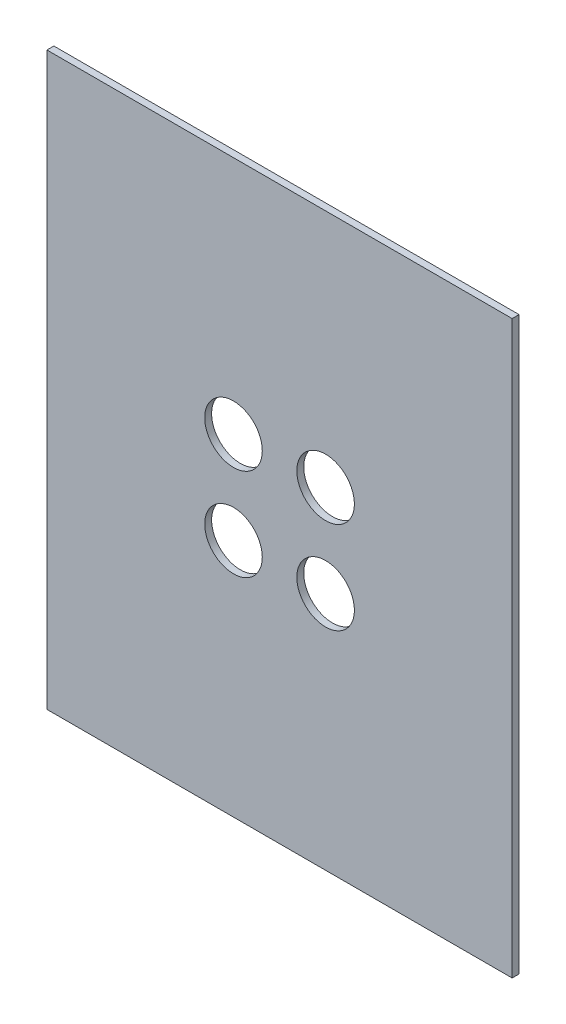
from build123d import *

# Parameters (mm, degrees)
ESQUISSE1_W             = 202
ESQUISSE1_H             = 248
BOSS_EXTRU_1_DEPTH      = 3
ESQUISSE2_R             = 12.5
ENL_V_MAT_EXTRU_1_DEPTH = 3


with BuildPart() as part:
    # Esquisse1 → Boss.-Extru.1 (new body)
    with BuildSketch(Plane.XY):
        with Locations((37.437440197, -46.807538036)):
            Rectangle(ESQUISSE1_W, ESQUISSE1_H)
    extrude(amount=BOSS_EXTRU_1_DEPTH)

    # Esquisse2 → Enlèv. mat.-Extru.1 (cut)
    with BuildSketch(Plane.XY.offset(3)):
        with Locations((17.437440197, -26.807538036)):
            Circle(ESQUISSE2_R)
        with Locations((57.437440197, -26.807538036)):
            Circle(ESQUISSE2_R)
        with Locations((57.437440197, -66.807538036)):
            Circle(ESQUISSE2_R)
        with Locations((17.437440197, -66.807538036)):
            Circle(ESQUISSE2_R)
    extrude(amount=-ENL_V_MAT_EXTRU_1_DEPTH, mode=Mode.SUBTRACT)


solid = part.part
